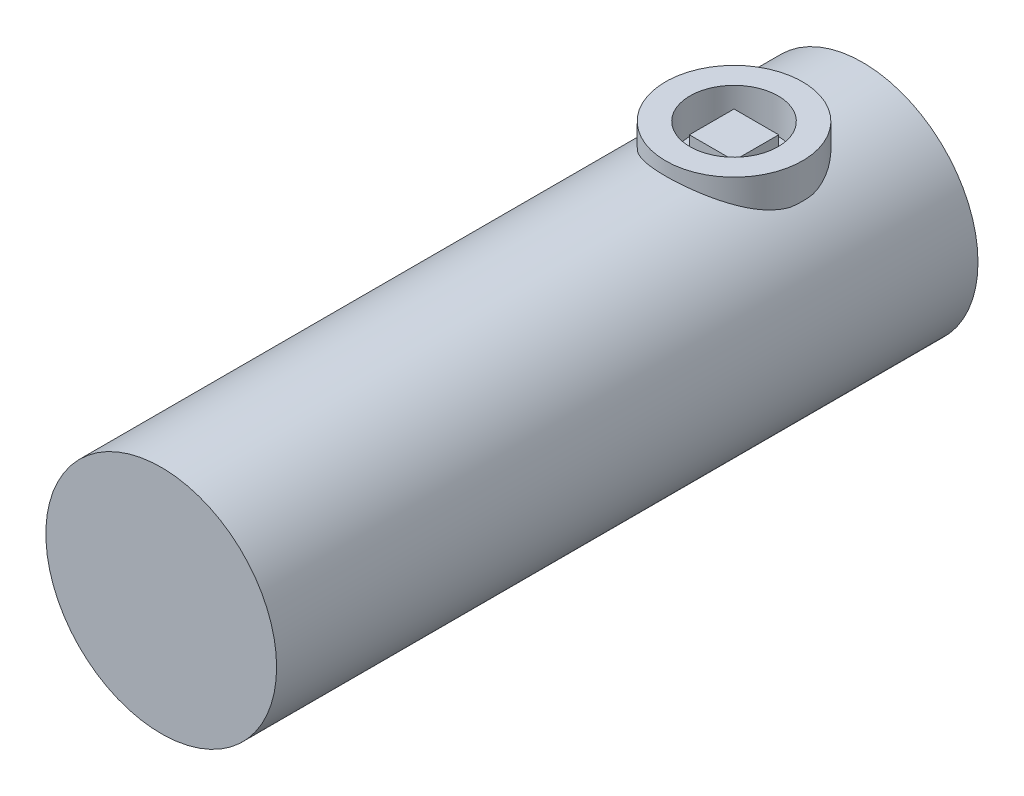
from build123d import *

# Parameters (mm, degrees)
SKETCH1_R           = 12.5349
BOSS_EXTRUDE1_DEPTH = 76.2
SKETCH2_R           = 4.7879
CUT_EXTRUDE1_DEPTH  = 76.2
SKETCH3_W           = 4.8514
SKETCH3_H           = 4.8514
BOSS_EXTRUDE2_DEPTH = 2.54
SKETCH4_R           = 7.4422
SKETCH4_R_2         = 4.7879
BOSS_EXTRUDE3_DEPTH = 3.81


with BuildPart() as part:
    # Sketch1 → Boss-Extrude1 (new body)
    with BuildSketch(Plane.XY):
        with Locations(Location((0, 0, 0), (0, 0, 180))):
            Circle(SKETCH1_R)
    extrude(amount=BOSS_EXTRUDE1_DEPTH)

    # Sketch2 → Cut-Extrude1 (cut)
    with BuildSketch(Plane(origin=(0, 10.16, 0), x_dir=(1, 0, 0), z_dir=(0, 1, 0))):
        with Locations(Location((0, -13.97, 0), (0, 0, 90))):
            Circle(SKETCH2_R)
    extrude(amount=CUT_EXTRUDE1_DEPTH, mode=Mode.SUBTRACT)

    # Sketch3 → Boss-Extrude2 (add)
    with BuildSketch(Plane(origin=(0, 10.16, 0), x_dir=(1, 0, 0), z_dir=(0, 1, 0))):
        with Locations((0, -13.97)):
            Rectangle(SKETCH3_W, SKETCH3_H)
    extrude(amount=BOSS_EXTRUDE2_DEPTH)

    # Sketch4 → Boss-Extrude3 (add)
    with BuildSketch(Plane(origin=(0, 10.16, 0), x_dir=(1, 0, 0), z_dir=(0, 1, 0))):
        with Locations(Location((0, -13.97, 0), (0, 0, 170.565483852))):
            Circle(SKETCH4_R)
        with Locations(Location((0, -13.97, 0), (0, 0, 90))):
            Circle(SKETCH4_R_2, mode=Mode.SUBTRACT)
    extrude(amount=BOSS_EXTRUDE3_DEPTH)


solid = part.part
